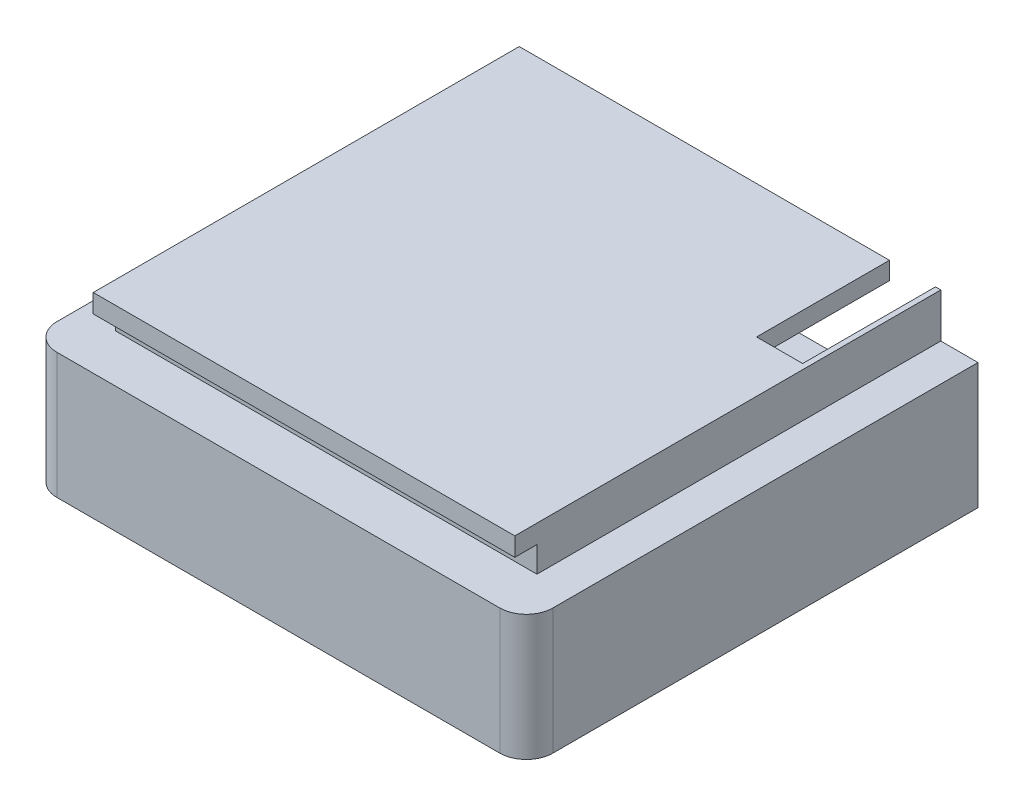
from build123d import *

# Parameters (mm, degrees)
BOSS_EXTRUDE8_DEPTH  = 10.2
SKETCH8_W            = 56
SKETCH8_H            = 51
BOSS_EXTRUDE9_DEPTH  = 2
CUT_EXTRUDE1_START   = -4
CUT_EXTRUDE1_DEPTH   = 48
SKETCH12_W           = 4
SKETCH12_H           = 51
CUT_EXTRUDE2_DEPTH   = 5
SKETCH11_W           = 56
SKETCH11_H           = 2
BOSS_EXTRUDE10_DEPTH = 51
SKETCH11_3_W         = 56
SKETCH11_3_H         = 2.5
BOSS_EXTRUDE11_DEPTH = 2.5
SKETCH11_4_W         = 56
SKETCH11_4_H         = 2.5
BOSS_EXTRUDE12_DEPTH = 5
SKETCH13_W           = 5
SKETCH13_H           = 48.5
BOSS_EXTRUDE13_DEPTH = 5
SKETCH14_W           = 5
SKETCH14_H           = 14.2
SKETCH14_H_2         = 7
CUT_EXTRUDE3_DEPTH   = 15
FILLET1_R            = 3
MOVE_FACE1_BY        = 0.2
MOVE_FACE1_2_BY      = 0.2
MOVE_FACE1_3_BY      = 0.2
MOVE_FACE1_4_BY      = 0.2
MOVE_FACE2_BY        = 0.2
MOVE_FACE2_2_BY      = 0.2
MOVE_FACE2_3_BY      = 0.2
MOVE_FACE2_4_BY      = 0.2
MOVE_FACE2_5_BY      = 0.2
MOVE_FACE3_BY        = 0.2
MOVE_FACE3_2_BY      = 0.2
MOVE_FACE3_3_BY      = 0.2
MOVE_FACE3_4_BY      = 0.2
MOVE_FACE3_5_BY      = 0.2
MOVE_FACE3_6_BY      = 0.2


with BuildPart() as part:
    # Sketch1 → Boss-Extrude8 (new body)
    with BuildSketch(Plane(origin=(0, 0, 0), x_dir=(1, 0, 0), z_dir=(0, 1, 0))):
        Polygon((0, 51), (5, 51), (5, 49), (5, 7), (51, 7), (51, 51), (56, 51), (56, 0), (0, 0), align=None)
    extrude(amount=BOSS_EXTRUDE8_DEPTH)

    # Sketch8 → Boss-Extrude9 (add)
    with BuildSketch(Plane(origin=(0, 10.2, 0), x_dir=(1, 0, 0), z_dir=(0, 1, 0))):
        with Locations((28, 25.5)):
            Rectangle(SKETCH8_W, SKETCH8_H)
    extrude(amount=BOSS_EXTRUDE9_DEPTH)

    # Sketch10 → Cut-Extrude1 (cut)
    with BuildSketch(Plane.ZY.offset(CUT_EXTRUDE1_START)):
        Polygon((0, 12.2), (-2.5, 12.2), (-2.5, 9.7), (-5, 9.7), (-5, 7.2), (0, 7.2), align=None)
    extrude(amount=-CUT_EXTRUDE1_DEPTH, mode=Mode.SUBTRACT)

    # Sketch12 → Cut-Extrude2 (cut)
    with BuildSketch(Plane(origin=(0, 12.2, 0), x_dir=(1, 0, 0), z_dir=(0, 1, 0))):
        with Locations((2, 25.5)):
            Rectangle(SKETCH12_W, SKETCH12_H)
        with Locations((54, 25.5)):
            Rectangle(SKETCH12_W, SKETCH12_H)
    extrude(amount=-CUT_EXTRUDE2_DEPTH, mode=Mode.SUBTRACT)

    # Sketch11 → Boss-Extrude10 (add)
    with BuildSketch(Plane.XY):
        with Locations((28, -1)):
            Rectangle(SKETCH11_W, SKETCH11_H)
    extrude(amount=-BOSS_EXTRUDE10_DEPTH)

    # Sketch11<3> → Boss-Extrude11 (add)
    with BuildSketch(Plane.XY):
        with Locations((28, -3.25)):
            Rectangle(SKETCH11_3_W, SKETCH11_3_H)
    extrude(amount=-BOSS_EXTRUDE11_DEPTH)

    # Sketch11<4> → Boss-Extrude12 (add)
    with BuildSketch(Plane.XY):
        with Locations((28, -5.75)):
            Rectangle(SKETCH11_4_W, SKETCH11_4_H)
    extrude(amount=-BOSS_EXTRUDE12_DEPTH)

    # Sketch13 → Boss-Extrude13 (add)
    with BuildSketch(Plane.XZ.offset(2)):
        with Locations((2.5, -26.75)):
            Rectangle(SKETCH13_W, SKETCH13_H)
        with Locations((53.5, -26.75)):
            Rectangle(SKETCH13_W, SKETCH13_H)
    extrude(amount=BOSS_EXTRUDE13_DEPTH)

    # Sketch14 → Cut-Extrude3 (cut)
    with BuildSketch(Plane(origin=(0, 0, -51), x_dir=(-1, 0, 0), z_dir=(0, 0, -1))):
        with Locations((-48.5, 5.1)):
            Rectangle(SKETCH14_W, SKETCH14_H)
        with Locations((-7.5, -3.5)):
            Rectangle(SKETCH14_W, SKETCH14_H_2)
    extrude(amount=-CUT_EXTRUDE3_DEPTH, mode=Mode.SUBTRACT)

    # Fillet1
    fillet1_edges = [part.edges().sort_by_distance(p)[0] for p in [
        (56, 0.1, 0),
        (0, 0.1, 0),
    ]]
    fillet(fillet1_edges, radius=FILLET1_R)

    # Move Face1: a face moved inward by 0.2
    extrude(part.faces().sort_by_distance((28, 9.7, -3.75))[0], amount=MOVE_FACE1_BY, dir=(0, 1, 0), mode=Mode.SUBTRACT)

    # Move Face1 2: a face moved inward by 0.2
    extrude(part.faces().sort_by_distance((28, 10.95, -2.5))[0], amount=MOVE_FACE1_2_BY, dir=(0, 0, -1), mode=Mode.SUBTRACT)

    # Move Face1 3: a face moved inward by 0.2
    extrude(part.faces().sort_by_distance((28, 8.45, -5))[0], amount=MOVE_FACE1_3_BY, dir=(0, 0, -1), mode=Mode.SUBTRACT)

    # Move Face1 4: a face moved inward by 0.2
    extrude(part.faces().sort_by_distance((28, -2, -25.542647765))[0], amount=MOVE_FACE1_4_BY, dir=(0, 1, 0), mode=Mode.SUBTRACT)

    # Move Face2: a face moved inward by 0.2
    extrude(part.faces().sort_by_distance((28, 9.9, -3.95))[0], amount=MOVE_FACE2_BY, dir=(0, 1, 0), mode=Mode.SUBTRACT)

    # Move Face2 2: a face moved inward by 0.2
    extrude(part.faces().sort_by_distance((28, 8.55, -5.2))[0], amount=MOVE_FACE2_2_BY, dir=(0, 0, -1), mode=Mode.SUBTRACT)

    # Move Face2 3: a face moved inward by 0.2
    extrude(part.faces().sort_by_distance((28, 11.05, -2.7))[0], amount=MOVE_FACE2_3_BY, dir=(0, 0, -1), mode=Mode.SUBTRACT)

    # Move Face2 4: a face moved inward by 0.2
    extrude(part.faces().sort_by_distance((52, 9.733067093, -27.508466454))[0], amount=MOVE_FACE2_4_BY, dir=(-1, 0, 0), mode=Mode.SUBTRACT)

    # Move Face2 5: a face moved inward by 0.2
    extrude(part.faces().sort_by_distance((4, 9.733067093, -27.508466454))[0], amount=MOVE_FACE2_5_BY, dir=(1, 0, 0), mode=Mode.SUBTRACT)

    # Move Face3: a face moved inward by 0.2
    extrude(part.faces().sort_by_distance((5, 1.649930724, -28.974870107))[0], amount=MOVE_FACE3_BY, dir=(-1, 0, 0), mode=Mode.SUBTRACT)

    # Move Face3 2: a face moved inward by 0.2
    extrude(part.faces().sort_by_distance((51, 2.03104423, -29.55452278))[0], amount=MOVE_FACE3_2_BY, dir=(1, 0, 0), mode=Mode.SUBTRACT)

    # Move Face3 3: a face moved inward by 0.2
    extrude(part.faces().sort_by_distance((28, -5.75, -5))[0], amount=MOVE_FACE3_3_BY, dir=(0, 0, 1), mode=Mode.SUBTRACT)

    # Move Face3 4: a face moved inward by 0.2
    extrude(part.faces().sort_by_distance((28, -4.5, -3.75))[0], amount=MOVE_FACE3_4_BY, dir=(0, -1, 0), mode=Mode.SUBTRACT)

    # Move Face3 5: a face moved inward by 0.2
    extrude(part.faces().sort_by_distance((28, -3.15, -2.5))[0], amount=MOVE_FACE3_5_BY, dir=(0, 0, 1), mode=Mode.SUBTRACT)

    # Move Face3 6: a face moved inward by 0.2
    extrude(part.faces().sort_by_distance((28, -1.8, -25.542647765))[0], amount=MOVE_FACE3_6_BY, dir=(0, 1, 0), mode=Mode.SUBTRACT)


solid = part.part
